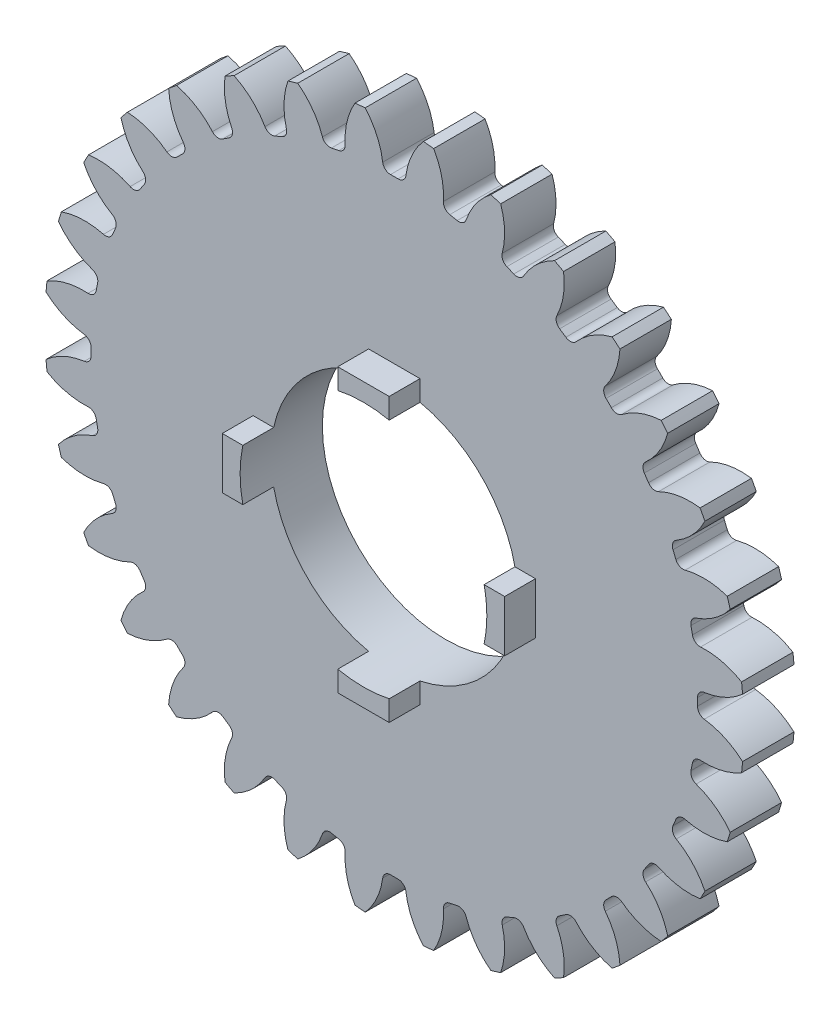
from build123d import *

# Parameters (mm, degrees)
SKETCH1_R                = 34
BOSS_EXTRUDE1_DEPTH      = 5
CUT_EXTRUDE1_DEPTH       = 10
FILLET2_R                = 0.76
CIRPATTERN2_COUNT        = 32
FILLET2_OF_CIRPATTERN2_R = 0.76
SKETCH2_R                = 12
CUT_EXTRUDE2_DEPTH       = 5
BOSS_EXTRUDE2_START      = 3
BOSS_EXTRUDE2_DEPTH      = 3


with BuildPart() as part:
    # Sketch1 → Boss-Extrude1 (new body)
    with BuildSketch(Plane.XY):
        Circle(SKETCH1_R)
    extrude(amount=-BOSS_EXTRUDE1_DEPTH)

    # Sketch1<4> → Cut-Extrude1 (cut)
    with BuildSketch(Plane.XY):
        with BuildLine():
            ThreePointArc((-1.070985492, 29.480552744), (0, 29.5), (1.070985492, 29.480552744))
            ThreePointArc((1.070985492, 29.480552744), (1.569608662, 31.834654314), (2.834643502, 33.881629185))
            ThreePointArc((2.834643502, 33.881629185), (0, 34), (-2.834643502, 33.881629185))
            ThreePointArc((-2.834643502, 33.881629185), (-1.569608662, 31.834654314), (-1.070985492, 29.480552744))
        make_face()
    cut_extrude1 = extrude(amount=-CUT_EXTRUDE1_DEPTH, mode=Mode.SUBTRACT)

    # Fillet2
    fillet2_edges = [part.edges().sort_by_distance(p)[0] for p in [
        (1.070985492, 29.480552744, -2.5),
        (-1.070985492, 29.480552744, -2.5),
    ]]
    fillet(fillet2_edges, radius=FILLET2_R)

    # CirPattern2: Cut-Extrude1 ×32 about axis
    cirpattern2_axis = Axis((0, 0, 0), (0, 0, 1))
    for i in range(1, CIRPATTERN2_COUNT):
        add(cut_extrude1.rotate(cirpattern2_axis, i * 360 / CIRPATTERN2_COUNT), mode=Mode.SUBTRACT)

    # Fillet2 of CirPattern2
    fillet2_of_cirpattern2_edges = [part.edges().sort_by_distance(p)[0] for p in [
        (-4.700963722, 29.123031094, -2.5),
        (-6.801777334, 28.705153285, -2.5),
        (-10.292257536, 27.646327691, -2.5),
        (-12.271180688, 26.826630883, -2.5),
        (-15.488025666, 25.10719142, -2.5),
        (-17.269009449, 23.917176101, -2.5),
        (-20.088597654, 21.603199862, -2.5),
        (-21.603199862, 20.088597654, -2.5),
        (-23.917176101, 17.269009449, -2.5),
        (-25.10719142, 15.488025666, -2.5),
        (-26.826630883, 12.271180688, -2.5),
        (-27.646327691, 10.292257536, -2.5),
        (-28.705153285, 6.801777334, -2.5),
        (-29.123031094, 4.700963722, -2.5),
        (-29.480552744, 1.070985492, -2.5),
        (-29.480552744, -1.070985492, -2.5),
        (-29.123031094, -4.700963722, -2.5),
        (-28.705153285, -6.801777334, -2.5),
        (-27.646327691, -10.292257536, -2.5),
        (-26.826630883, -12.271180688, -2.5),
        (-25.10719142, -15.488025666, -2.5),
        (-23.917176101, -17.269009449, -2.5),
        (-21.603199862, -20.088597654, -2.5),
        (-20.088597654, -21.603199862, -2.5),
        (-17.269009449, -23.917176101, -2.5),
        (-15.488025666, -25.10719142, -2.5),
        (-12.271180688, -26.826630883, -2.5),
        (-10.292257536, -27.646327691, -2.5),
        (-6.801777334, -28.705153285, -2.5),
        (-4.700963722, -29.123031094, -2.5),
        (-1.070985492, -29.480552744, -2.5),
        (1.070985492, -29.480552744, -2.5),
        (4.700963722, -29.123031094, -2.5),
        (6.801777334, -28.705153285, -2.5),
        (10.292257536, -27.646327691, -2.5),
        (12.271180688, -26.826630883, -2.5),
        (15.488025666, -25.10719142, -2.5),
        (17.269009449, -23.917176101, -2.5),
        (20.088597654, -21.603199862, -2.5),
        (21.603199862, -20.088597654, -2.5),
        (23.917176101, -17.269009449, -2.5),
        (25.10719142, -15.488025666, -2.5),
        (26.826630883, -12.271180688, -2.5),
        (27.646327691, -10.292257536, -2.5),
        (28.705153285, -6.801777334, -2.5),
        (29.123031094, -4.700963722, -2.5),
        (29.480552744, -1.070985492, -2.5),
        (29.480552744, 1.070985492, -2.5),
        (29.123031094, 4.700963722, -2.5),
        (28.705153285, 6.801777334, -2.5),
        (27.646327691, 10.292257536, -2.5),
        (26.826630883, 12.271180688, -2.5),
        (25.10719142, 15.488025666, -2.5),
        (23.917176101, 17.269009449, -2.5),
        (21.603199862, 20.088597654, -2.5),
        (20.088597654, 21.603199862, -2.5),
        (17.269009449, 23.917176101, -2.5),
        (15.488025666, 25.10719142, -2.5),
        (12.271180688, 26.826630883, -2.5),
        (10.292257536, 27.646327691, -2.5),
        (6.801777334, 28.705153285, -2.5),
        (4.700963722, 29.123031094, -2.5),
    ]]
    fillet(fillet2_of_cirpattern2_edges, radius=FILLET2_OF_CIRPATTERN2_R)

    # Sketch2 → Cut-Extrude2 (cut)
    with BuildSketch(Plane.XY):
        Circle(SKETCH2_R)
    extrude(amount=-CUT_EXTRUDE2_DEPTH, mode=Mode.SUBTRACT)

    # Sketch3 → Boss-Extrude2 (add)
    with BuildSketch(Plane.XY.offset(BOSS_EXTRUDE2_START)):
        with BuildLine():
            Line((-2.5, 11.736694594), (-2.5, 13.736694594))
            Line((-2.5, 13.736694594), (2.5, 13.736694594))
            Line((2.5, 13.736694594), (2.5, 11.736694594))
            ThreePointArc((2.5, 11.736694594), (0, 12), (-2.5, 11.736694594))
        make_face()
        with BuildLine():
            Line((13.736694594, -2.5), (11.736694594, -2.5))
            ThreePointArc((11.736694594, -2.5), (12, 0), (11.736694594, 2.5))
            Line((11.736694594, 2.5), (13.736694594, 2.5))
            Line((13.736694594, 2.5), (13.736694594, -2.5))
        make_face()
        with BuildLine():
            Line((-2.5, -13.736694594), (-2.5, -11.736694594))
            ThreePointArc((-2.5, -11.736694594), (0, -12), (2.5, -11.736694594))
            Line((2.5, -11.736694594), (2.5, -13.736694594))
            Line((2.5, -13.736694594), (-2.5, -13.736694594))
        make_face()
        with BuildLine():
            Line((-13.736694594, 2.5), (-11.736694594, 2.5))
            ThreePointArc((-11.736694594, 2.5), (-12, 0), (-11.736694594, -2.5))
            Line((-11.736694594, -2.5), (-13.736694594, -2.5))
            Line((-13.736694594, -2.5), (-13.736694594, 2.5))
        make_face()
    extrude(amount=-BOSS_EXTRUDE2_DEPTH)


solid = part.part
